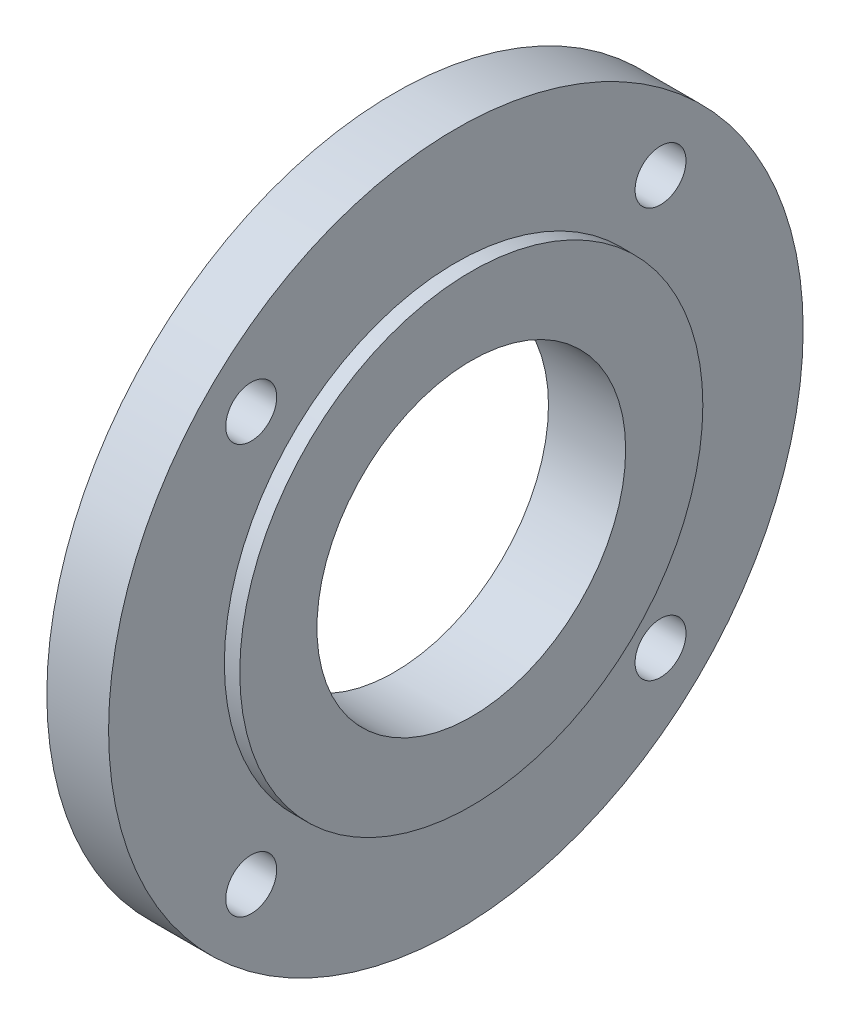
from build123d import *

# Parameters (mm, degrees)
SKETCH_1_R          = 15
EXTRUDE_1_DEPTH     = 5
SKETCH_3_R          = 22.5
EXTRUDE_3_DEPTH     = 4
SKETCH_6_R          = 10
CUT_EXTRUDE_2_DEPTH = 33.210246817
HOLE_WIZARD_M4_1_D  = 3.3


with BuildPart() as part:
    # 草图1 → 凸台-拉伸1 (new body)
    with BuildSketch(Plane(origin=(0, 0, 0), x_dir=(0, 0, -1), z_dir=(1, 0, 0))):
        Circle(SKETCH_1_R)
    extrude(amount=EXTRUDE_1_DEPTH)

    # 草图3 → 凸台-拉伸3 (add)
    with BuildSketch(Plane.ZY):
        Circle(SKETCH_3_R)
    extrude(amount=-EXTRUDE_3_DEPTH)

    # 草图6 → 切除-拉伸2 (cut, through all)
    with BuildSketch(Plane(origin=(5, 0, 0), x_dir=(0, 0, -1), z_dir=(1, 0, 0))):
        Circle(SKETCH_6_R)
    extrude(amount=-CUT_EXTRUDE_2_DEPTH, mode=Mode.SUBTRACT)

    # M4 螺纹孔1 (through all)
    with Locations(Plane(origin=(4, 0, 0), x_dir=(0, 0, -1), z_dir=(1, 0, 0))):
        with Locations((-13.258252147, 13.258252147), (13.258252147, 13.258252147), (13.258252147, -13.258252147), (-13.258252147, -13.258252147), (0, 0)):
            Hole(HOLE_WIZARD_M4_1_D / 2)


solid = part.part
